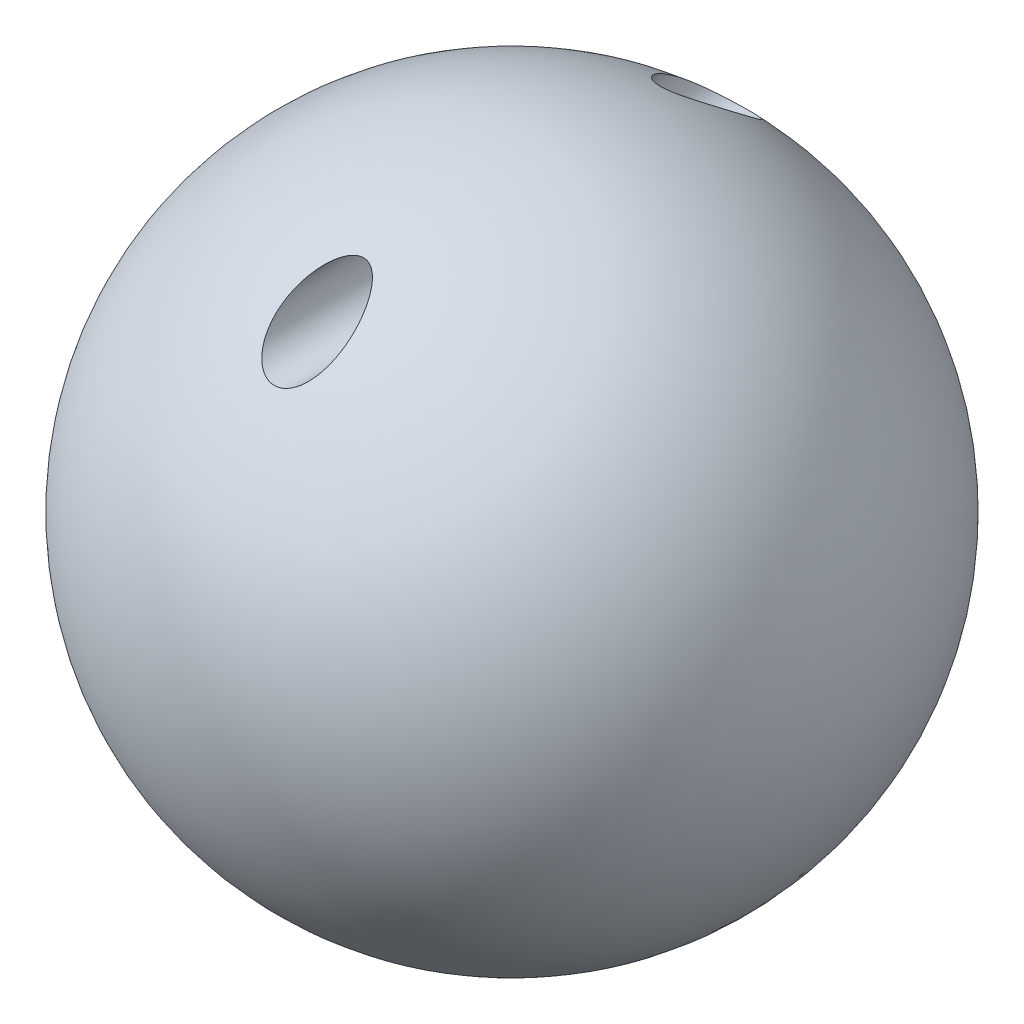
from build123d import *

# Parameters (mm, degrees)
CUT_EXTRUDE3_DEPTH      = 32.108519733
CUT_EXTRUDE3_DEPTH_BACK = 32.108519733
SKETCH2_R               = 1.27


with BuildPart() as part:
    # Sketch1 → Revolve1 (revolve)
    with BuildSketch(Plane.XY):
        with BuildLine():
            Line((0, 0), (0, 25.4))
            ThreePointArc((0, 25.4), (12.7, 12.7), (0, 0))
        make_face()
    revolve(axis=Axis((0, 0, 0), (0, 1, 0)))

    # Sketch2 → Cut-Extrude3 (cut, two sides: drawn at the far end of the back side and taken through both)
    with BuildSketch(Plane.XY.offset(-CUT_EXTRUDE3_DEPTH_BACK)):
        with Locations(Location((0, 22.770356356, 0), (0, 0, 126.134872412))):
            Circle(SKETCH2_R)
    extrude(amount=CUT_EXTRUDE3_DEPTH + CUT_EXTRUDE3_DEPTH_BACK, mode=Mode.SUBTRACT)


solid = part.part
